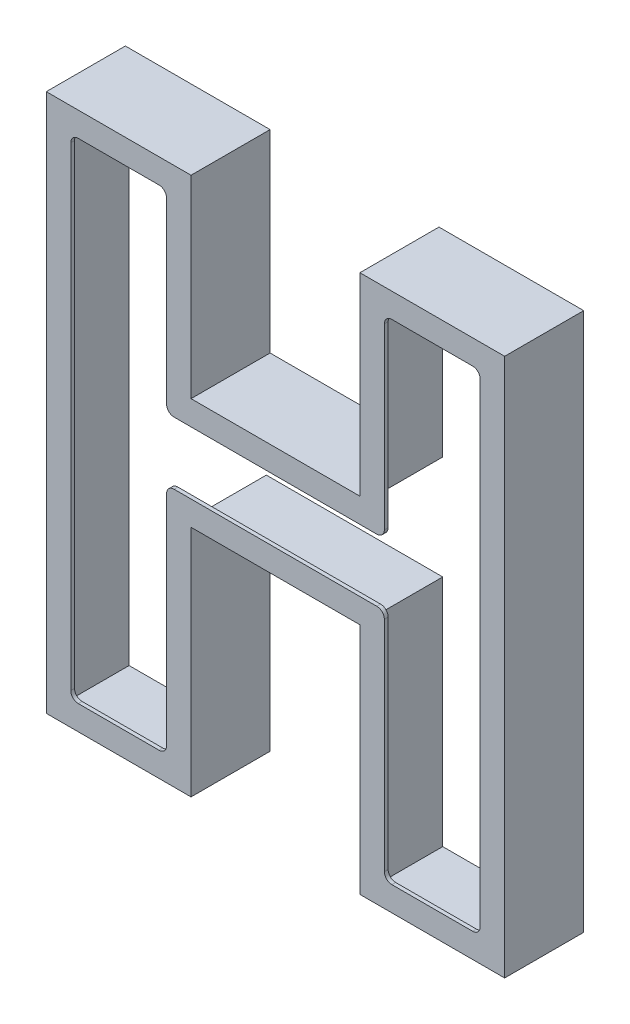
from build123d import *

# Parameters (mm, degrees)
BOSS_EXTRUDE1_DEPTH      = 1
BOSS_EXTRUDE1_DEPTH_BACK = 20
CUT_EXTRUDE1_DEPTH       = 3814.653559302
CUT_EXTRUDE2_DEPTH       = 20
FILLET1_R                = 2


with BuildPart() as part:
    # Sketch1 → Boss-Extrude1 (new, two sides: drawn at the far end of the back side and taken through both)
    with BuildSketch(Plane.XY.offset(-BOSS_EXTRUDE1_DEPTH_BACK)):
        Polygon((3401.843352704, -1645.582577839), (3440.286390679, -1645.582577839), (3440.286390679, -1502.582577839), (3401.843352704, -1502.582577839), (3401.843352704, -1553.974982902), (3356.995251438, -1553.974982902), (3356.995251438, -1502.582577839), (3318.552213464, -1502.582577839), (3318.552213464, -1645.582577839), (3356.995251438, -1645.582577839), (3356.995251438, -1583.557261383), (3401.843352704, -1583.557261383), align=None)
    extrude(amount=BOSS_EXTRUDE1_DEPTH + BOSS_EXTRUDE1_DEPTH_BACK)

    # Sketch2 → Cut-Extrude1 (cut, through all)
    with BuildSketch(Plane.XY.offset(1)):
        Polygon((3408.343352704, -1577.057261383), (3408.343352704, -1639.082577839), (3433.786390679, -1639.082577839), (3433.786390679, -1509.082577839), (3408.343352704, -1509.082577839), (3408.343352704, -1560.474982902), (3350.495251438, -1560.474982902), (3350.495251438, -1509.082577839), (3325.052213464, -1509.082577839), (3325.052213464, -1639.082577839), (3350.495251438, -1639.082577839), (3350.495251438, -1577.057261383), align=None)
    extrude(amount=-CUT_EXTRUDE1_DEPTH, mode=Mode.SUBTRACT)

    # Sketch3 → Cut-Extrude2 (cut)
    with BuildSketch(Plane(origin=(0, 0, -20), x_dir=(-1, 0, 0), z_dir=(0, 0, -1))):
        Polygon((-3402.843352704, -1644.582577839), (-3402.843352704, -1582.557261383), (-3355.995251438, -1582.557261383), (-3355.995251438, -1644.582577839), (-3319.552213464, -1644.582577839), (-3319.552213464, -1503.582577839), (-3355.995251438, -1503.582577839), (-3355.995251438, -1554.974982902), (-3402.843352704, -1554.974982902), (-3402.843352704, -1503.582577839), (-3439.286390679, -1503.582577839), (-3439.286390679, -1644.582577839), align=None)
    extrude(amount=-CUT_EXTRUDE2_DEPTH, mode=Mode.SUBTRACT)

    # Fillet1
    fillet1_edges = [part.edges().sort_by_distance(p)[0] for p in [
        (3408.343352704, -1639.082577839, 0.5),
        (3408.343352704, -1577.057261383, 0.5),
        (3433.786390679, -1639.082577839, 0.5),
        (3433.786390679, -1509.082577839, 0.5),
        (3408.343352704, -1509.082577839, 0.5),
        (3408.343352704, -1560.474982902, 0.5),
        (3350.495251438, -1560.474982902, 0.5),
        (3350.495251438, -1509.082577839, 0.5),
        (3325.052213464, -1509.082577839, 0.5),
        (3325.052213464, -1639.082577839, 0.5),
        (3350.495251438, -1639.082577839, 0.5),
        (3350.495251438, -1577.057261383, 0.5),
    ]]
    fillet(fillet1_edges, radius=FILLET1_R)


solid = part.part
